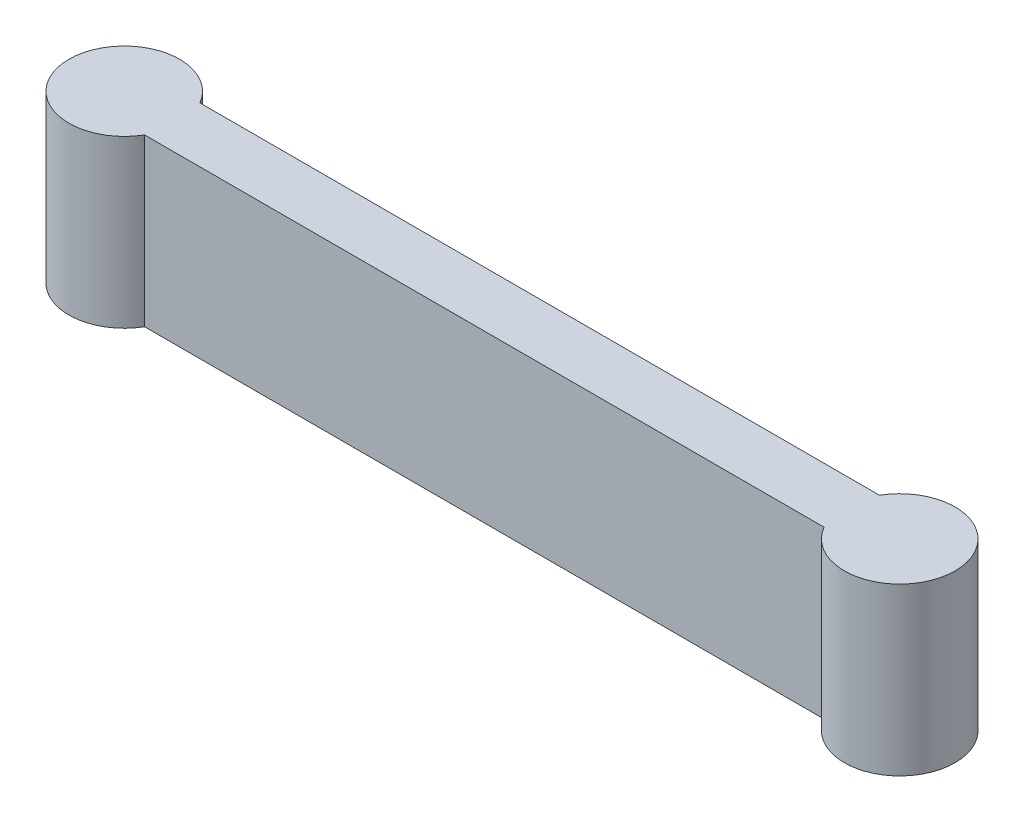
from build123d import *

# Parameters (mm, degrees)
BOSS_EXTRUDE1_DEPTH      = 75
BOSS_EXTRUDE1_DEPTH_BACK = 75


with BuildPart() as part:
    # Sketch1 → Boss-Extrude1 (new, two sides: drawn at the far end of the back side and taken through both)
    with BuildSketch(Plane(origin=(0, 0, 0), x_dir=(1, 0, 0), z_dir=(0, 1, 0)).offset(-BOSS_EXTRUDE1_DEPTH_BACK)):
        with BuildLine():
            Line((43.301270189, -25), (656.698729811, -25))
            ThreePointArc((656.698729811, -25), (750, 0), (656.698729811, 25))
            Line((656.698729811, 25), (43.301270189, 25))
            ThreePointArc((43.301270189, 25), (-50, 0), (43.301270189, -25))
        make_face()
    extrude(amount=BOSS_EXTRUDE1_DEPTH + BOSS_EXTRUDE1_DEPTH_BACK)


solid = part.part
